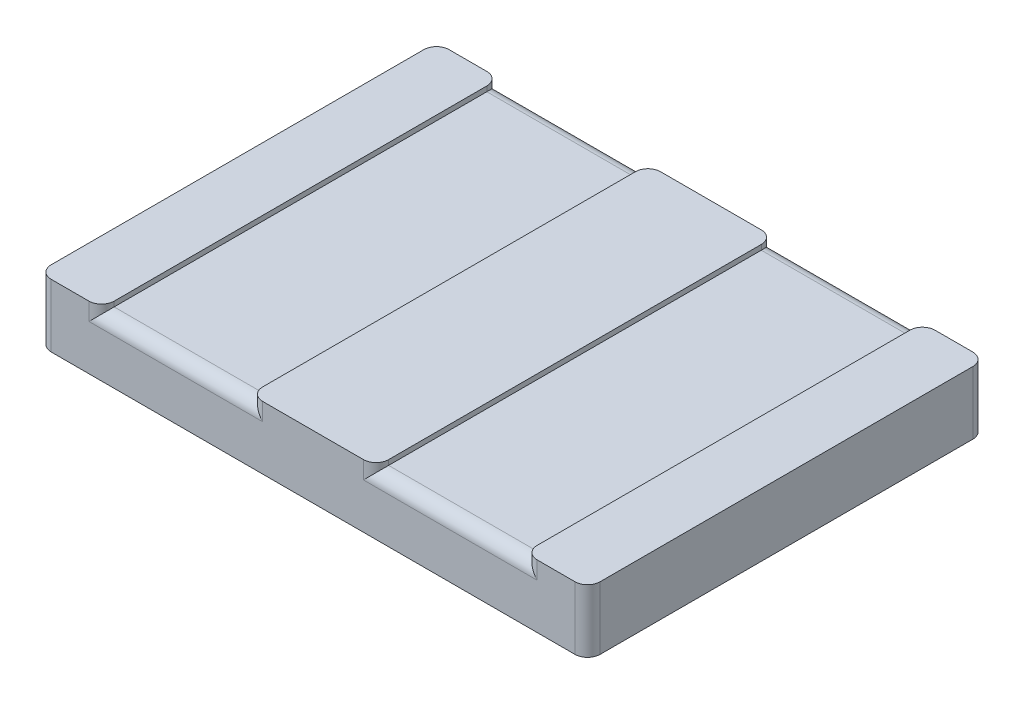
from build123d import *

# Parameters (mm, degrees)
EXTRUDE_1_DEPTH      = 7.9
EXTRUDE_1_DEPTH_BACK = 7.9
FILLET_1_R           = 0.5


with BuildPart() as part:
    # Эскиз1 → Бобышка-Вытянуть1 (new, two sides: drawn at the far end of the back side and taken through both)
    with BuildSketch(Plane.XY.offset(-EXTRUDE_1_DEPTH_BACK)):
        Polygon((-10.9, 0), (10.9, 0), (10.9, 2.5), (8.4, 2.5), (8.4, 2.3), (2.5, 2.3), (2.5, 2.5), (-2.5, 2.5), (-2.5, 2.3), (-8.4, 2.3), (-8.4, 2.5), (-10.9, 2.5), align=None)
    extrude(amount=EXTRUDE_1_DEPTH + EXTRUDE_1_DEPTH_BACK)

    # Скругление1
    fillet_1_edges = [part.edges().sort_by_distance(p)[0] for p in [
        (-5.45, 2.3, -7.9),
        (-2.5, 2.4, -7.9),
        (-8.4, 2.4, -7.9),
        (-10.9, 1.25, -7.9),
        (2.5, 2.4, -7.9),
        (5.45, 2.3, -7.9),
        (8.4, 2.4, -7.9),
        (10.9, 1.25, -7.9),
        (10.9, 1.25, 7.9),
        (8.4, 2.4, 7.9),
        (5.45, 2.3, 7.9),
        (2.5, 2.4, 7.9),
        (-2.5, 2.4, 7.9),
        (-5.45, 2.3, 7.9),
        (-8.4, 2.4, 7.9),
        (-10.9, 1.25, 7.9),
    ]]
    fillet(fillet_1_edges, radius=FILLET_1_R)


solid = part.part
